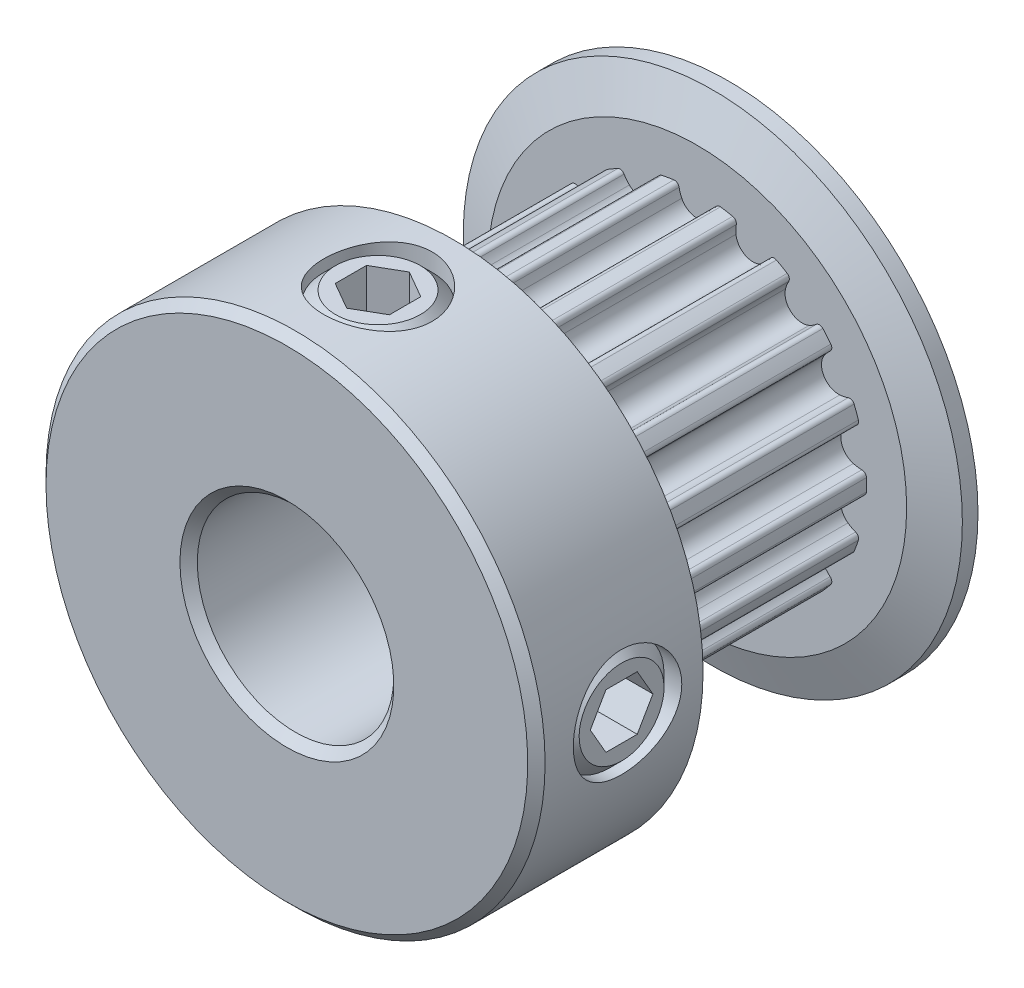
from build123d import *

# Parameters (mm, degrees)
CUT_EXTRUDE1_START = 1.245
CUT_EXTRUDE1_DEPTH = 7.37
CIRPATTERN1_COUNT  = 18
SKETCH4_R          = 1.7526
CUT_EXTRUDE2_DEPTH = 14.452901007
CUT_EXTRUDE3_DEPTH = 1.31445
CIRPATTERN3_COUNT  = 2
CIRPATTERN3_ANGLE  = 90
CHAMFER1_SIZE      = 0.28075


with BuildPart() as part:
    # Sketch2 → Revolve1 (revolve)
    with BuildSketch(Plane(origin=(0, 0, 0), x_dir=(0, 0, -1), z_dir=(1, 0, 0)), mode=Mode.PRIVATE) as revolve1_sk:
        Polygon((-7.135, 3.175), (7.135, 3.175), (7.135, 8.0645), (6.63, 8.0645), (6.125, 6.769), (6.125, 5.4735), (-1.245, 5.4735), (-1.245, 6.769), (-1.75, 8.0645), (-7.135, 8.0645), align=None)
    revolve(revolve1_sk.sketch.rotate(Axis((0, 0, 7.135), (0, 0, -1)), 90), axis=Axis((0, 0, 7.135), (0, 0, -1)))

    # Sketch3 → Cut-Extrude1 (cut)
    with BuildSketch(Plane.XY.offset(CUT_EXTRUDE1_START)):
        with BuildLine():
            Line((2.952836064, 8.0645), (-2.952836064, 8.0645))
            Line((-2.952836064, 8.0645), (-1.881947675, 5.139793303))
            ThreePointArc((-1.881947675, 5.139793303), (-1.324980471, 5.310708898), (-0.75300182, 5.421456493))
            ThreePointArc((-0.75300182, 5.421456493), (-0.644149516, 5.394199903), (-0.584666069, 5.299050203))
            ThreePointArc((-0.584666069, 5.299050203), (-0.550959727, 5.164185276), (-0.498876404, 5.035297753))
            ThreePointArc((-0.498876404, 5.035297753), (0, 4.7235), (0.498876404, 5.035297753))
            ThreePointArc((0.498876404, 5.035297753), (0.550959727, 5.164185276), (0.584666069, 5.299050203))
            ThreePointArc((0.584666069, 5.299050203), (0.644149516, 5.394199903), (0.75300182, 5.421456493))
            ThreePointArc((0.75300182, 5.421456493), (1.324980471, 5.310708898), (1.881947675, 5.139793303))
            Line((1.881947675, 5.139793303), (2.952836064, 8.0645))
        make_face()
    cut_extrude1 = extrude(amount=-CUT_EXTRUDE1_DEPTH, mode=Mode.SUBTRACT)

    # CirPattern1: Cut-Extrude1 ×18 about axis
    cirpattern1_axis = Axis((0, 0, 0), (0, 0, 1))
    for i in range(1, CIRPATTERN1_COUNT):
        add(cut_extrude1.rotate(cirpattern1_axis, i * 360 / CIRPATTERN1_COUNT), mode=Mode.SUBTRACT)

    # Sketch4 → Cut-Extrude2 (cut, through all)
    with BuildSketch(Plane(origin=(0, 0, 0), x_dir=(0, -1, 0), z_dir=(1, 0, 0))):
        with Locations(Location((0, -4.19, 0), (0, 0, 270))):
            Circle(SKETCH4_R)
    cut_extrude2 = extrude(amount=CUT_EXTRUDE2_DEPTH, mode=Mode.SUBTRACT)

    # Sketch5 → Revolve2 (revolve)
    with BuildSketch(Plane.XY.offset(4.19), mode=Mode.PRIVATE) as revolve2_sk:
        Polygon((3.175, -1.3716), (3.175, 0), (7.871756697, 0), (7.871756697, -1.3716), (7.490756697, -1.7526), (3.556, -1.7526), align=None)
    revolve2 = revolve(revolve2_sk.sketch.rotate(Axis((3.175, 0, 4.19), (1, 0, 0)), 270), axis=Axis((3.175, 0, 4.19), (1, 0, 0)))

    # Sketch6 → Cut-Extrude3 (cut)
    with BuildSketch(Plane(origin=(7.871756697, 5.384140679, 0), x_dir=(0, -1, 0), z_dir=(-1, 0, 0))):
        Polygon((5.384140679, 5.201864082), (4.507840679, 4.695932041), (4.507840679, 3.684067959), (5.384140679, 3.178135918), (6.260440679, 3.684067959), (6.260440679, 4.695932041), align=None)
    cut_extrude3 = extrude(amount=CUT_EXTRUDE3_DEPTH, mode=Mode.SUBTRACT)

    # CirPattern3: Cut-Extrude2, Revolve2, Cut-Extrude3 ×2 about axis
    cirpattern3_axis = Axis((0, 0, 0), (0, 0, 1))
    add([cut_extrude2.rotate(cirpattern3_axis, i * CIRPATTERN3_ANGLE / (CIRPATTERN3_COUNT - 1)) for i in range(1, CIRPATTERN3_COUNT)], mode=Mode.SUBTRACT)
    add([revolve2.rotate(cirpattern3_axis, i * CIRPATTERN3_ANGLE / (CIRPATTERN3_COUNT - 1)) for i in range(1, CIRPATTERN3_COUNT)])
    add([cut_extrude3.rotate(cirpattern3_axis, i * CIRPATTERN3_ANGLE / (CIRPATTERN3_COUNT - 1)) for i in range(1, CIRPATTERN3_COUNT)], mode=Mode.SUBTRACT)

    # Chamfer1
    chamfer1_edges = [part.edges().sort_by_distance(p)[0] for p in [
        (-3.175, 0, 7.135),
        (-8.0645, 0, 7.135),
    ]]
    chamfer(chamfer1_edges, length=CHAMFER1_SIZE)


solid = part.part
